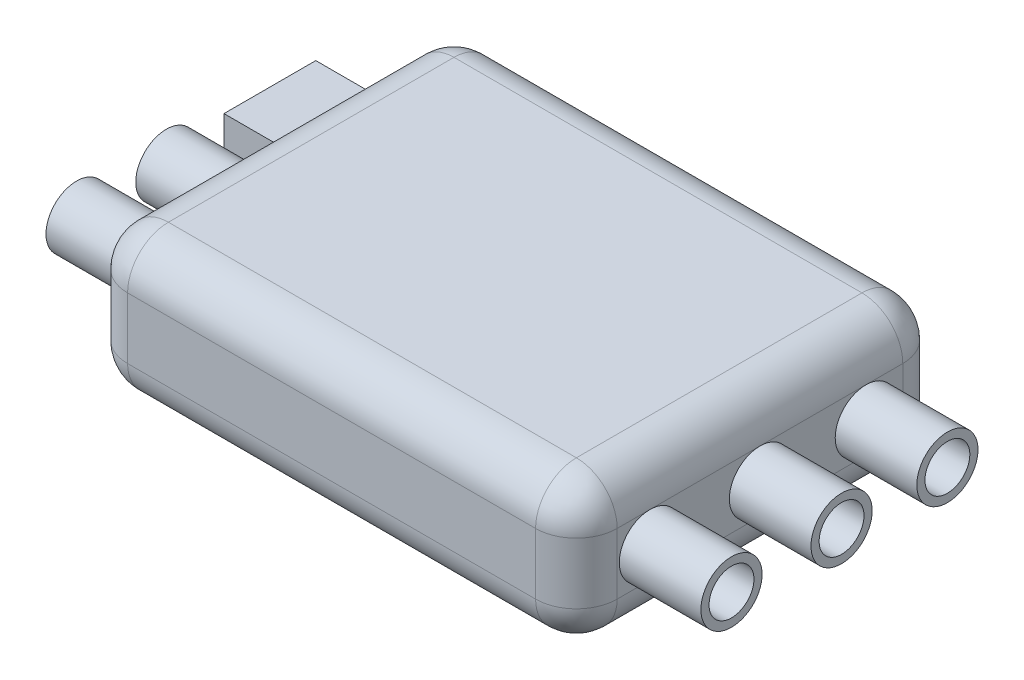
from build123d import *

# Parameters (mm, degrees)
BOSS_EXTRUDE1_DEPTH = 7
FILLET1_R           = 2
FILLET2_R           = 2
SKETCH2_R           = 1.5
SKETCH2_R_2         = 1.1
BOSS_EXTRUDE2_DEPTH = 4
SKETCH3_R           = 1.5
SKETCH3_R_2         = 1.1
SKETCH3_W           = 4.5
SKETCH3_H           = 1.5
BOSS_EXTRUDE3_DEPTH = 4


with BuildPart() as part:
    # Sketch1 → Boss-Extrude1 (new body)
    with BuildSketch(Plane(origin=(0, 0, 0), x_dir=(1, 0, 0), z_dir=(0, 1, 0))):
        with BuildLine():
            Line((10, -9), (-10, -9))
            ThreePointArc((-10, -9), (-11.414213562, -8.414213562), (-12, -7))
            Line((-12, -7), (-12, 7))
            ThreePointArc((-12, 7), (-11.414213562, 8.414213562), (-10, 9))
            Line((-10, 9), (10, 9))
            ThreePointArc((10, 9), (11.414213562, 8.414213562), (12, 7))
            Line((12, 7), (12, -7))
            ThreePointArc((12, -7), (11.414213562, -8.414213562), (10, -9))
        make_face()
    extrude(amount=BOSS_EXTRUDE1_DEPTH)

    # Fillet1
    fillet1_edges = [part.edges().sort_by_distance(p)[0] for p in [
        (11.414213562, 7, 8.414213562),
        (12, 7, 0),
        (11.414213562, 7, -8.414213562),
        (0, 7, -9),
        (-11.414213562, 7, -8.414213562),
        (-12, 7, 0),
        (-11.414213562, 7, 8.414213562),
        (0, 7, 9),
    ]]
    fillet(fillet1_edges, radius=FILLET1_R)

    # Fillet2
    fillet2_edges = [part.edges().sort_by_distance(p)[0] for p in [
        (12, 0, 0),
        (11.414213562, 0, 8.414213562),
        (0, 0, 9),
        (-11.414213562, 0, 8.414213562),
        (-12, 0, 0),
        (-11.414213562, 0, -8.414213562),
        (0, 0, -9),
        (11.414213562, 0, -8.414213562),
    ]]
    fillet(fillet2_edges, radius=FILLET2_R)

    # Sketch2 → Boss-Extrude2 (add)
    # profile 1 of 3: a face of its own
    with BuildSketch(Plane(origin=(12, 0, 0), x_dir=(0, 0, -1), z_dir=(1, 0, 0))):
        with Locations(Location((0, 3.5, 0), (0, 0, 270))):
            Circle(SKETCH2_R)
        with Locations((0, 3.5)):
            Circle(SKETCH2_R_2, mode=Mode.SUBTRACT)
    # profile 2 of 3: a face of its own
    with BuildSketch(Plane(origin=(12, 0, 0), x_dir=(0, 0, -1), z_dir=(1, 0, 0))):
        with Locations(Location((5.1879565, 3.5, 0), (0, 0, 270))):
            Circle(SKETCH2_R)
        with Locations((5.1879565, 3.5)):
            Circle(SKETCH2_R_2, mode=Mode.SUBTRACT)
    # profile 3 of 3: a face of its own
    with BuildSketch(Plane(origin=(12, 0, 0), x_dir=(0, 0, -1), z_dir=(1, 0, 0))):
        with Locations(Location((-5.396168524, 3.5, 0), (0, 0, 270))):
            Circle(SKETCH2_R)
        with Locations((-5.396168524, 3.5)):
            Circle(SKETCH2_R_2, mode=Mode.SUBTRACT)
    extrude(amount=BOSS_EXTRUDE2_DEPTH)

    # Sketch3 → Boss-Extrude3 (add)
    # profile 1 of 3: a face of its own
    with BuildSketch(Plane.ZY.offset(12)):
        with Locations((5.5, 3.5)):
            Circle(SKETCH3_R)
        with Locations((5.5, 3.5)):
            Circle(SKETCH3_R_2, mode=Mode.SUBTRACT)
    # profile 2 of 3: a face of its own
    with BuildSketch(Plane.ZY.offset(12)):
        with Locations(Location((1.1, 3.5, 0), (0, 0, 270))):
            Circle(SKETCH3_R)
        with Locations((1.1, 3.5)):
            Circle(SKETCH3_R_2, mode=Mode.SUBTRACT)
    # profile 3 of 3: a face of its own
    with BuildSketch(Plane.ZY.offset(12)):
        with Locations((-3.974486265, 3.5)):
            Rectangle(SKETCH3_W, SKETCH3_H)
    extrude(amount=BOSS_EXTRUDE3_DEPTH)


solid = part.part
